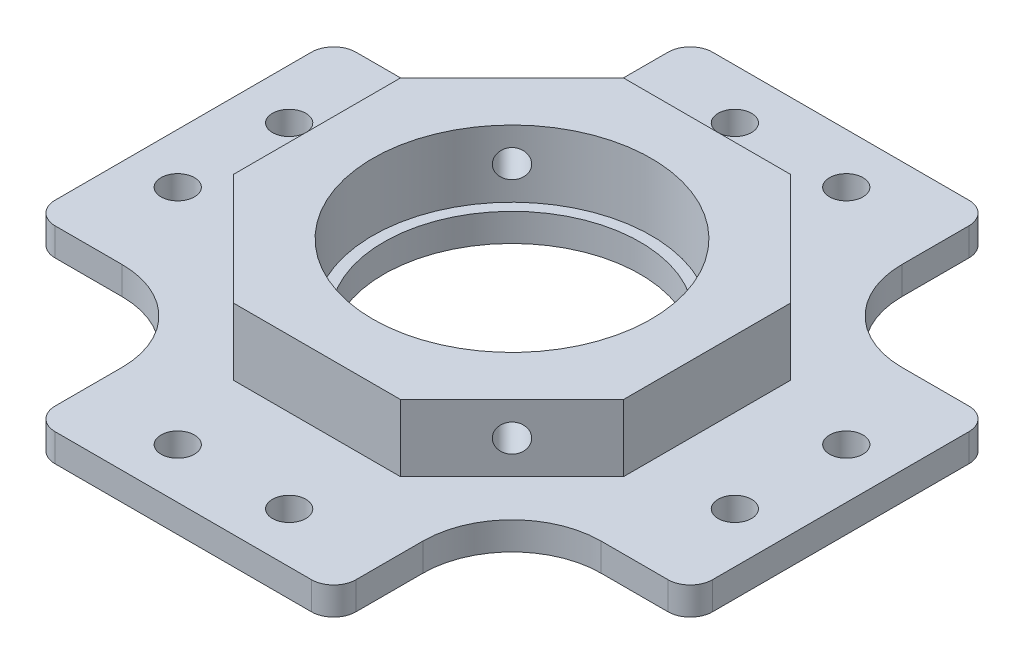
from build123d import *

# Parameters (mm, degrees)
SKETCH_1_R               = 11.5
SKETCH_1_R_2             = 1.5
EXTRUDE_1_DEPTH          = 2.5
SKETCH_2_R               = 12.5
EXTRUDE_2_DEPTH          = 6
HOLE_WIZARD_M3_1_REACH   = 61.651
HOLE_WIZARD_M3_1_BORE_R  = 1.25
PATTERN_CIRCULAR_1_COUNT = 4


with BuildPart() as part:
    # 草图1 → 凸台-拉伸1 (new body)
    with BuildSketch(Plane(origin=(0, 0, 0), x_dir=(1, 0, 0), z_dir=(0, 1, 0))):
        with BuildLine():
            Line((-11.5, 29.5), (11.5, 29.5))
            ThreePointArc((11.5, 29.5), (12.914213562, 28.914213562), (13.5, 27.5))
            Line((13.5, 27.5), (13.5, 21.5))
            ThreePointArc((13.5, 21.5), (15.843145751, 15.843145751), (21.5, 13.5))
            Line((21.5, 13.5), (27.5, 13.5))
            ThreePointArc((27.5, 13.5), (28.914213562, 12.914213562), (29.5, 11.5))
            Line((29.5, 11.5), (29.5, -11.5))
            ThreePointArc((29.5, -11.5), (28.914213562, -12.914213562), (27.5, -13.5))
            Line((27.5, -13.5), (21.5, -13.5))
            ThreePointArc((21.5, -13.5), (15.843145751, -15.843145751), (13.5, -21.5))
            Line((13.5, -21.5), (13.5, -27.5))
            ThreePointArc((13.5, -27.5), (12.914213562, -28.914213562), (11.5, -29.5))
            Line((11.5, -29.5), (-11.5, -29.5))
            ThreePointArc((-11.5, -29.5), (-12.914213562, -28.914213562), (-13.5, -27.5))
            Line((-13.5, -27.5), (-13.5, -21.5))
            ThreePointArc((-13.5, -21.5), (-15.843145751, -15.843145751), (-21.5, -13.5))
            Line((-21.5, -13.5), (-27.5, -13.5))
            ThreePointArc((-27.5, -13.5), (-28.914213562, -12.914213562), (-29.5, -11.5))
            Line((-29.5, -11.5), (-29.5, 11.5))
            ThreePointArc((-29.5, 11.5), (-28.914213562, 12.914213562), (-27.5, 13.5))
            Line((-27.5, 13.5), (-21.5, 13.5))
            ThreePointArc((-21.5, 13.5), (-15.843145751, 15.843145751), (-13.5, 21.5))
            Line((-13.5, 21.5), (-13.5, 27.5))
            ThreePointArc((-13.5, 27.5), (-12.914213562, 28.914213562), (-11.5, 29.5))
        make_face()
        with Locations(Location((0, 0, 0), (0, 0, 270))):
            Circle(SKETCH_1_R, mode=Mode.SUBTRACT)
        with Locations(Location((-5, 25, 0), (0, 0, 270))):
            Circle(SKETCH_1_R_2, mode=Mode.SUBTRACT)
        with Locations(Location((5, 25, 0), (0, 0, 90))):
            Circle(SKETCH_1_R_2, mode=Mode.SUBTRACT)
        with Locations(Location((25, 5, 0), (0, 0, 270))):
            Circle(SKETCH_1_R_2, mode=Mode.SUBTRACT)
        with Locations(Location((25, -5, 0), (0, 0, 90))):
            Circle(SKETCH_1_R_2, mode=Mode.SUBTRACT)
        with Locations(Location((5, -25, 0), (0, 0, 270))):
            Circle(SKETCH_1_R_2, mode=Mode.SUBTRACT)
        with Locations(Location((-5, -25, 0), (0, 0, 90))):
            Circle(SKETCH_1_R_2, mode=Mode.SUBTRACT)
        with Locations(Location((-25, -5, 0), (0, 0, 270))):
            Circle(SKETCH_1_R_2, mode=Mode.SUBTRACT)
        with Locations(Location((-25, 5, 0), (0, 0, 90))):
            Circle(SKETCH_1_R_2, mode=Mode.SUBTRACT)
    extrude(amount=EXTRUDE_1_DEPTH)

    # 草图2 → 凸台-拉伸2 (add)
    with BuildSketch(Plane(origin=(0, 2.5, 0), x_dir=(1, 0, 0), z_dir=(0, 1, 0))):
        Polygon((17.5, 7.5), (7.5, 17.5), (-7.5, 17.5), (-17.5, 7.5), (-17.5, -7.5), (-7.5, -17.5), (7.5, -17.5), (17.5, -7.5), align=None)
        with Locations(Location((0, 0, 0), (0, 0, 270))):
            Circle(SKETCH_2_R, mode=Mode.SUBTRACT)
    extrude(amount=EXTRUDE_2_DEPTH)

    # M3 螺纹孔1 bore (on position points) → M3 螺纹孔1 (cut, up to next)
    with BuildSketch(Plane(origin=(-12.5, 5.5, 12.5), x_dir=(0.707106781187, 0, 0.707106781187), z_dir=(-0.707106781187, 0, 0.707106781187)), mode=Mode.PRIVATE) as hole_wizard_m3_1_sk1:
        Circle(HOLE_WIZARD_M3_1_BORE_R)
    hole_wizard_m3_1_tool1 = extrude(hole_wizard_m3_1_sk1.sketch, amount=-HOLE_WIZARD_M3_1_REACH, mode=Mode.PRIVATE) & part.part
    hole_wizard_m3_1 = hole_wizard_m3_1_tool1.solids().sort_by_distance((-12.5, 5.5, 12.5))[0]
    add(hole_wizard_m3_1, mode=Mode.SUBTRACT)

    # 阵列(圆周)1: M3 螺纹孔1 ×4 about axis
    pattern_circular_1_axis = Axis((0, 8.5, 0), (0, -1, 0))
    for i in range(1, PATTERN_CIRCULAR_1_COUNT):
        add(hole_wizard_m3_1.rotate(pattern_circular_1_axis, i * 360 / PATTERN_CIRCULAR_1_COUNT), mode=Mode.SUBTRACT)


solid = part.part
